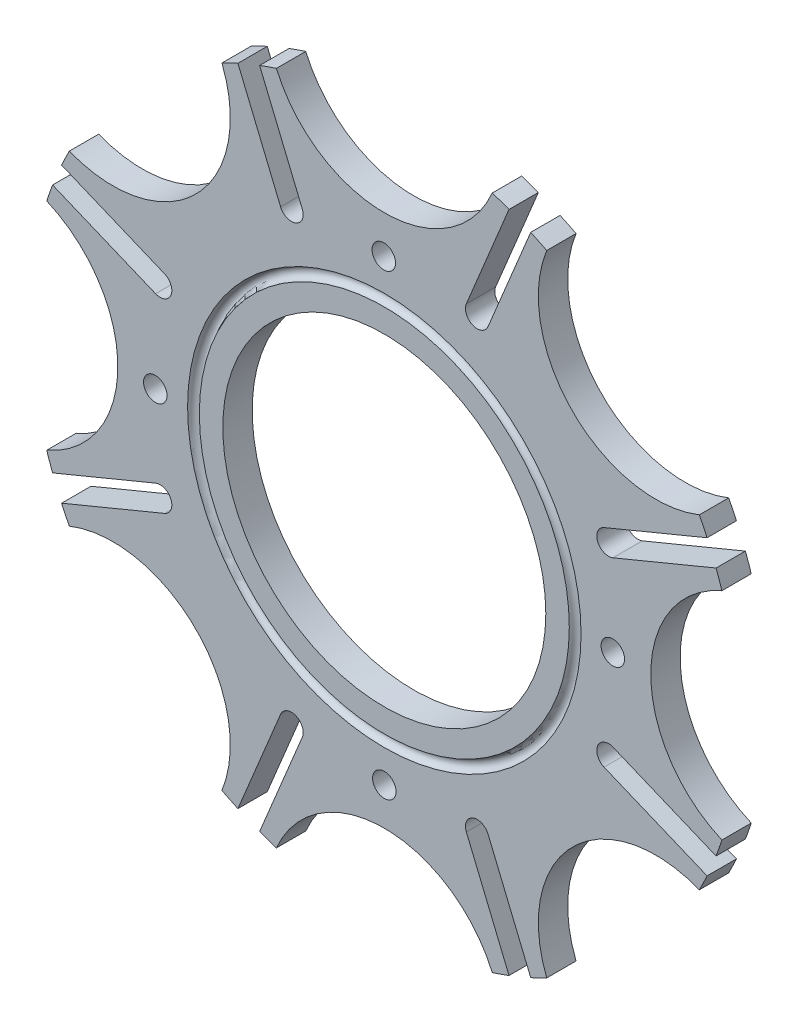
from build123d import *

# Parameters (mm, degrees)
SKETCH1_R            = 55
SKETCH1_R_2          = 4
BOSS_EXTRUDE1_DEPTH  = 10
CUT_SWEEP1_PROFILE_R = 2


with BuildPart() as part:
    # Sketch1 → Boss-Extrude1 (new body)
    with BuildSketch(Plane.XY):
        with BuildLine():
            ThreePointArc((-42.468063511, -112.979478614), (-39.624142049, -114.008010127), (-36.755344443, -114.964967103))
            ThreePointArc((-36.755344443, -114.964967103), (0, -90.746115822), (36.755344443, -114.964967103))
            ThreePointArc((36.755344443, -114.964967103), (39.624142049, -114.008010127), (42.468063511, -112.979478614))
            Line((42.468063511, -112.979478614), (27.935607979, -77.895027374))
            ThreePointArc((27.935607979, -77.895027374), (30.100392379, -72.668775514), (35.326644239, -74.833559915))
            Line((35.326644239, -74.833559915), (49.859099771, -109.918011155))
            ThreePointArc((49.859099771, -109.918011155), (52.597337529, -108.634336612), (55.302554537, -107.282461138))
            ThreePointArc((55.302554537, -107.282461138), (64.167193864, -64.167193864), (107.282461138, -55.302554537))
            ThreePointArc((107.282461138, -55.302554537), (108.634336612, -52.597337529), (109.918011155, -49.859099771))
            Line((109.918011155, -49.859099771), (74.833559915, -35.326644239))
            ThreePointArc((74.833559915, -35.326644239), (72.668775514, -30.100392379), (77.895027374, -27.935607979))
            Line((77.895027374, -27.935607979), (112.979478614, -42.468063511))
            ThreePointArc((112.979478614, -42.468063511), (114.008010127, -39.624142049), (114.964967103, -36.755344443))
            ThreePointArc((114.964967103, -36.755344443), (90.746115822, 0), (114.964967103, 36.755344443))
            ThreePointArc((114.964967103, 36.755344443), (114.008010127, 39.624142049), (112.979478614, 42.468063511))
            Line((112.979478614, 42.468063511), (77.895027374, 27.935607979))
            ThreePointArc((77.895027374, 27.935607979), (72.668775514, 30.100392379), (74.833559915, 35.326644239))
            Line((74.833559915, 35.326644239), (109.918011155, 49.859099771))
            ThreePointArc((109.918011155, 49.859099771), (108.634336612, 52.597337529), (107.282461138, 55.302554537))
            ThreePointArc((107.282461138, 55.302554537), (64.167193864, 64.167193864), (55.302554537, 107.282461138))
            ThreePointArc((55.302554537, 107.282461138), (52.597337529, 108.634336612), (49.859099771, 109.918011155))
            Line((49.859099771, 109.918011155), (35.326644239, 74.833559915))
            ThreePointArc((35.326644239, 74.833559915), (30.100392379, 72.668775514), (27.935607979, 77.895027374))
            Line((27.935607979, 77.895027374), (42.468063511, 112.979478614))
            ThreePointArc((42.468063511, 112.979478614), (39.624142049, 114.008010127), (36.755344443, 114.964967103))
            ThreePointArc((36.755344443, 114.964967103), (0, 90.746115822), (-36.755344443, 114.964967103))
            ThreePointArc((-36.755344443, 114.964967103), (-39.624142049, 114.008010127), (-42.468063511, 112.979478614))
            Line((-42.468063511, 112.979478614), (-27.935607979, 77.895027374))
            ThreePointArc((-27.935607979, 77.895027374), (-30.100392379, 72.668775514), (-35.326644239, 74.833559915))
            Line((-35.326644239, 74.833559915), (-49.859099771, 109.918011155))
            ThreePointArc((-49.859099771, 109.918011155), (-52.597337529, 108.634336612), (-55.302554537, 107.282461138))
            ThreePointArc((-55.302554537, 107.282461138), (-64.167193864, 64.167193864), (-107.282461138, 55.302554537))
            ThreePointArc((-107.282461138, 55.302554537), (-108.634336612, 52.597337529), (-109.918011155, 49.859099771))
            Line((-109.918011155, 49.859099771), (-74.833559915, 35.326644239))
            ThreePointArc((-74.833559915, 35.326644239), (-72.668775514, 30.100392379), (-77.895027374, 27.935607979))
            Line((-77.895027374, 27.935607979), (-112.979478614, 42.468063511))
            ThreePointArc((-112.979478614, 42.468063511), (-114.008010127, 39.624142049), (-114.964967103, 36.755344443))
            ThreePointArc((-114.964967103, 36.755344443), (-90.746115822, 0), (-114.964967103, -36.755344443))
            ThreePointArc((-114.964967103, -36.755344443), (-114.008010127, -39.624142049), (-112.979478614, -42.468063511))
            Line((-112.979478614, -42.468063511), (-77.895027374, -27.935607979))
            ThreePointArc((-77.895027374, -27.935607979), (-72.668775514, -30.100392379), (-74.833559915, -35.326644239))
            Line((-74.833559915, -35.326644239), (-109.918011155, -49.859099771))
            ThreePointArc((-109.918011155, -49.859099771), (-108.634336612, -52.597337529), (-107.282461138, -55.302554537))
            ThreePointArc((-107.282461138, -55.302554537), (-64.167193864, -64.167193864), (-55.302554537, -107.282461138))
            ThreePointArc((-55.302554537, -107.282461138), (-52.597337529, -108.634336612), (-49.859099771, -109.918011155))
            Line((-49.859099771, -109.918011155), (-35.326644239, -74.833559915))
            ThreePointArc((-35.326644239, -74.833559915), (-30.100392379, -72.668775514), (-27.935607979, -77.895027374))
            Line((-27.935607979, -77.895027374), (-42.468063511, -112.979478614))
        make_face()
        Circle(SKETCH1_R, mode=Mode.SUBTRACT)
        with Locations((-78, -0.18)):
            Circle(SKETCH1_R_2, mode=Mode.SUBTRACT)
        with Locations((0, -78)):
            Circle(SKETCH1_R_2, mode=Mode.SUBTRACT)
        with Locations((77.82, 0)):
            Circle(SKETCH1_R_2, mode=Mode.SUBTRACT)
        with Locations((-0.18, 77.82)):
            Circle(SKETCH1_R_2, mode=Mode.SUBTRACT)
    extrude(amount=BOSS_EXTRUDE1_DEPTH)

    # Cut-Sweep1: sweep along a path in Sketch6
    with BuildLine(Plane(origin=(0, 0, 10), x_dir=(-1, 0, 0), z_dir=(0, 0, -1))) as cut_sweep1_path:
        CenterArc((0, 0), 65, 0, 360)
    # Cut-Sweep1 profile (on start of the path) → Cut-Sweep1 (sweep, cut)
    with BuildSketch(Plane(origin=(-65, 0, 10), x_dir=(0, 0, 1), z_dir=(0, 1, 0))):
        Circle(CUT_SWEEP1_PROFILE_R)
    sweep(path=cut_sweep1_path.line, mode=Mode.SUBTRACT)


solid = part.part
